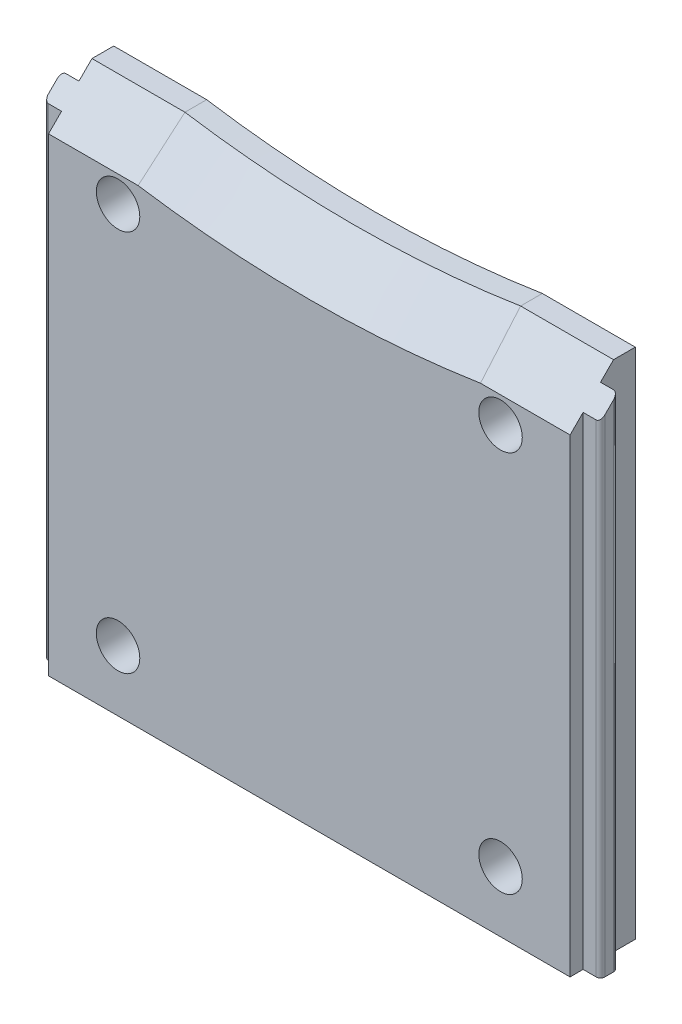
from build123d import *

# Parameters (mm, degrees)
BOSS_EXTRUDE1_DEPTH = 3.81
SKETCH3_R           = 1.27
CUT_EXTRUDE1_DEPTH  = 3.81
SKETCH4_W           = 1.016
SKETCH4_H           = 31.065921614
BOSS_EXTRUDE3_DEPTH = 1.016
FILLET2_R           = 0.254
FILLET3_R           = 0.254
SKETCH5_W           = 35.250778146
SKETCH5_H           = 1.778
CUT_EXTRUDE2_DEPTH  = 3.81
CHAMFER1_SIZE       = 2.54


with BuildPart() as part:
    # Sketch1 → Boss-Extrude1 (new body)
    with BuildSketch(Plane.XY):
        with BuildLine():
            Line((15.24, -15.875), (-15.24, -15.875))
            Line((-15.24, -15.875), (-15.24, 15.190921614))
            ThreePointArc((-15.24, 15.190921614), (0, 13.335), (15.24, 15.190921614))
            Line((15.24, 15.190921614), (15.24, -15.875))
        make_face()
    extrude(amount=BOSS_EXTRUDE1_DEPTH)

    # Sketch3 → Cut-Extrude1 (cut)
    with BuildSketch(Plane.XY.offset(3.81)):
        with Locations((-11.176, 10.033)):
            Circle(SKETCH3_R)
        with Locations((11.176, 10.033)):
            Circle(SKETCH3_R)
        with Locations((11.176, -12.319)):
            Circle(SKETCH3_R)
        with Locations((-11.176, -12.319)):
            Circle(SKETCH3_R)
    extrude(amount=-CUT_EXTRUDE1_DEPTH, mode=Mode.SUBTRACT)

    # Sketch4 → Boss-Extrude3 (add)
    with BuildSketch(Plane.ZY.offset(15.24)):
        with Locations((2.54, -0.342039193)):
            Rectangle(SKETCH4_W, SKETCH4_H)
    boss_extrude3 = extrude(amount=BOSS_EXTRUDE3_DEPTH)

    # Fillet2
    fillet2_edges = [part.edges().sort_by_distance(p)[0] for p in [
        (-16.256, -0.342039193, 2.032),
        (-16.256, -0.342039193, 3.048),
    ]]
    fillet(fillet2_edges, radius=FILLET2_R)

    # Mirror4: Boss-Extrude3 across plane
    add(boss_extrude3.mirror(Plane(origin=(0, 0, 0), x_dir=(0, 0, 1), z_dir=(1, 0, 0))))

    # Fillet3
    fillet3_edges = [part.edges().sort_by_distance(p)[0] for p in [
        (16.256, -0.342039193, 2.032),
        (16.256, -0.342039193, 3.048),
    ]]
    fillet(fillet3_edges, radius=FILLET3_R)

    # Sketch5 → Cut-Extrude2 (cut)
    with BuildSketch(Plane.XY.offset(3.81)):
        with Locations((-0.154610927, 14.986)):
            Rectangle(SKETCH5_W, SKETCH5_H)
    extrude(amount=-CUT_EXTRUDE2_DEPTH, mode=Mode.SUBTRACT)

    # Chamfer1
    chamfer1_edges = [part.edges().sort_by_distance(p)[0] for p in [
        (12.523910582, 14.097, 3.81),
        (-12.523910582, 14.097, 3.81),
        (0, 13.335, 3.81),
    ]]
    chamfer(chamfer1_edges, length=CHAMFER1_SIZE)


solid = part.part
